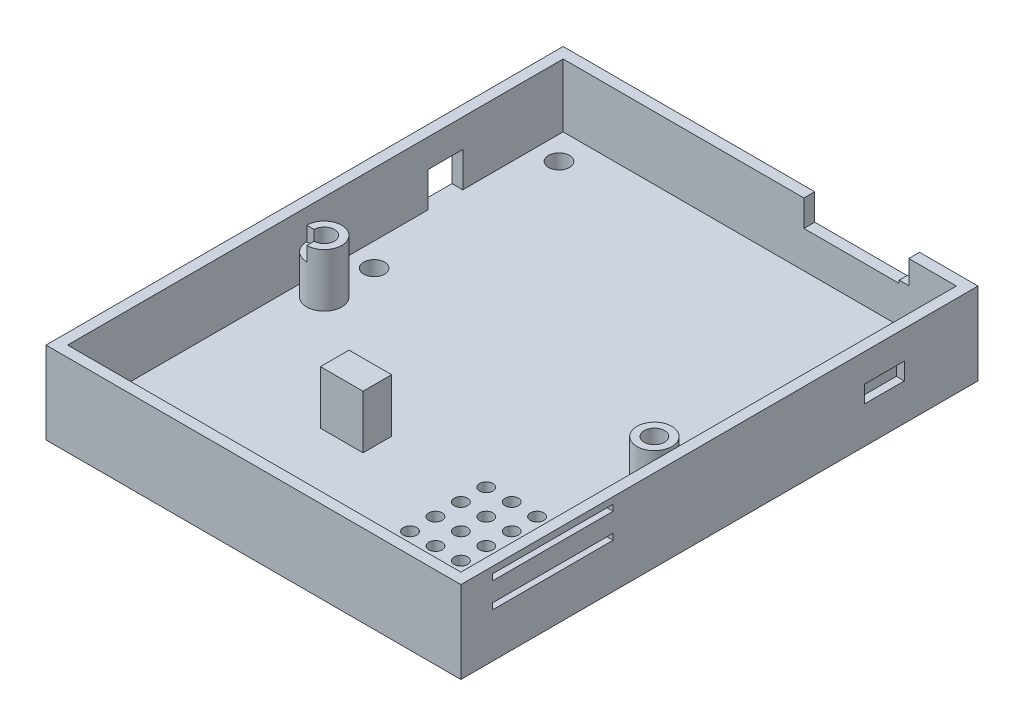
from build123d import *

# Parameters (mm, degrees)
SKETCH2_W                = 65.3
SKETCH2_H                = 81.4
BOSS_EXTRUDE1_DEPTH      = 3
SKETCH3_W                = 65.3
SKETCH3_H                = 81.4
SKETCH3_W_2              = 61.9
SKETCH3_H_2              = 78
BOSS_EXTRUDE2_DEPTH      = 9.94
SKETCH4_R                = 1.65
SKETCH4_R_2              = 1.6
SKETCH4_W                = 6.7
SKETCH4_H                = 4.5
CUT_EXTRUDE1_DEPTH       = 90.156922291
BOSS_EXTRUDE3_DEPTH      = 10.15
BOSS_EXTRUDE3_DEPTH_BACK = 3
SKETCH5_W                = 6.7
SKETCH5_H                = 4.5
SKETCH6_R                = 2.75
BOSS_EXTRUDE4_DEPTH      = 10.15
BOSS_EXTRUDE4_2_DEPTH    = 10.15
CUT_EXTRUDE2_DEPTH       = 4
SKETCH17_R               = 1.6
CUT_EXTRUDE11_DEPTH      = 90.571623254
SKETCH19_W               = 5.5
SKETCH19_H               = 5.5
CUT_EXTRUDE12_DEPTH      = 98.237493387
SKETCH20_W               = 15
SKETCH20_H               = 4.15
CUT_EXTRUDE13_DEPTH      = 96.592458239
SKETCH21_R               = 2.75
CUT_EXTRUDE14_DEPTH      = 1.75
SKETCH22_R               = 2.75
CUT_EXTRUDE15_DEPTH      = 1.75
SKETCH23_W               = 6.7
SKETCH23_H               = 4.5
CUT_EXTRUDE16_DEPTH      = 1.75
SKETCH10_R               = 1.05
CUT_EXTRUDE5_DEPTH       = 90.156922291
SKETCH11_W               = 6.3
SKETCH11_H               = 2.7
CUT_EXTRUDE6_DEPTH       = 1.25
SKETCH15_W               = 16.1
SKETCH15_H               = 3.7
CUT_EXTRUDE9_DEPTH       = 96.563796347
SKETCH16_W               = 18.956236151
SKETCH16_H               = 0.955067826
CUT_EXTRUDE10_DEPTH      = 1.7


with BuildPart() as part:
    # Sketch2 → Boss-Extrude1 (new body)
    with BuildSketch(Plane(origin=(0, 0, 0), x_dir=(1, 0, 0), z_dir=(0, 1, 0))):
        with Locations((-18.466588034, -31.668830446)):
            Rectangle(SKETCH2_W, SKETCH2_H)
    extrude(amount=BOSS_EXTRUDE1_DEPTH)

    # Sketch3 → Boss-Extrude2 (add)
    with BuildSketch(Plane(origin=(0, 3, 0), x_dir=(1, 0, 0), z_dir=(0, 1, 0))):
        with Locations((-18.466588034, -31.668830446)):
            Rectangle(SKETCH3_W, SKETCH3_H)
        with Locations((-18.466588034, -31.668830446)):
            Rectangle(SKETCH3_W_2, SKETCH3_H_2, mode=Mode.SUBTRACT)
    extrude(amount=BOSS_EXTRUDE2_DEPTH)

    # Sketch4 → Cut-Extrude1 (cut, through all)
    with BuildSketch(Plane(origin=(0, 3, 0), x_dir=(1, 0, 0), z_dir=(0, 1, 0))):
        with Locations(Location((-45.716588034, 2.981169554, 0), (0, 0, 270))):
            Circle(SKETCH4_R)
        with Locations(Location((-45.716588034, -26.118830446, 0), (0, 0, 270))):
            Circle(SKETCH4_R)
        with Locations(Location((7.483411966, 2.981169554, 0), (0, 0, 270))):
            Circle(SKETCH4_R)
        with Locations(Location((7.483411966, -26.118830446, 0), (0, 0, 270))):
            Circle(SKETCH4_R)
        with Locations(Location((-45.716588034, -33.968830446, 0), (0, 0, 270))):
            Circle(SKETCH4_R_2)
        with Locations(Location((7.677742326, -35.398830446, 0), (0, 0, 270))):
            Circle(SKETCH4_R_2)
        with Locations((-24.766588034, -49.918830446)):
            Rectangle(SKETCH4_W, SKETCH4_H)
    extrude(amount=-CUT_EXTRUDE1_DEPTH, mode=Mode.SUBTRACT)

    # Sketch19 → Cut-Extrude12 (cut, through all)
    with BuildSketch(Plane(origin=(-49.416588034, 0, 0), x_dir=(0, 0, -1), z_dir=(1, 0, 0))):
        with Locations((-11.218830446, 5.75)):
            Rectangle(SKETCH19_W, SKETCH19_H)
    extrude(amount=-CUT_EXTRUDE12_DEPTH, mode=Mode.SUBTRACT)

    # Sketch20 → Cut-Extrude13 (cut, through all)
    with BuildSketch(Plane.XY.offset(-7.331169554)):
        with Locations((-4.016588034, 10.865)):
            Rectangle(SKETCH20_W, SKETCH20_H)
    extrude(amount=-CUT_EXTRUDE13_DEPTH, mode=Mode.SUBTRACT)

    # Sketch10 → Cut-Extrude5 (cut, through all)
    with BuildSketch(Plane(origin=(0, 3, 0), x_dir=(1, 0, 0), z_dir=(0, 1, 0))):
        with Locations(Location((-7.016588034, -47.168830446, 0), (0, 0, 270))):
            Circle(SKETCH10_R)
        with Locations(Location((-3.016588034, -47.168830446, 0), (0, 0, 270))):
            Circle(SKETCH10_R)
        with Locations(Location((0.983411966, -47.168830446, 0), (0, 0, 270))):
            Circle(SKETCH10_R)
        with Locations(Location((4.983411966, -47.168830446, 0), (0, 0, 270))):
            Circle(SKETCH10_R)
        with Locations(Location((8.983411966, -47.168830446, 0), (0, 0, 270))):
            Circle(SKETCH10_R)
        with Locations(Location((-3.016588034, -51.168830446, 0), (0, 0, 270))):
            Circle(SKETCH10_R)
        with Locations(Location((0.983411966, -51.168830446, 0), (0, 0, 270))):
            Circle(SKETCH10_R)
        with Locations(Location((4.983411966, -51.168830446, 0), (0, 0, 270))):
            Circle(SKETCH10_R)
        with Locations(Location((8.983411966, -51.168830446, 0), (0, 0, 270))):
            Circle(SKETCH10_R)
        with Locations(Location((-3.016588034, -55.168830446, 0), (0, 0, 270))):
            Circle(SKETCH10_R)
        with Locations(Location((0.983411966, -55.168830446, 0), (0, 0, 270))):
            Circle(SKETCH10_R)
        with Locations(Location((4.983411966, -55.168830446, 0), (0, 0, 270))):
            Circle(SKETCH10_R)
        with Locations(Location((8.983411966, -55.168830446, 0), (0, 0, 270))):
            Circle(SKETCH10_R)
        with Locations(Location((-3.016588034, -59.168830446, 0), (0, 0, 270))):
            Circle(SKETCH10_R)
        with Locations(Location((0.983411966, -59.168830446, 0), (0, 0, 270))):
            Circle(SKETCH10_R)
        with Locations(Location((4.983411966, -59.168830446, 0), (0, 0, 270))):
            Circle(SKETCH10_R)
        with Locations(Location((8.983411966, -59.168830446, 0), (0, 0, 270))):
            Circle(SKETCH10_R)
        with Locations(Location((-7.016588034, -51.168830446, 0), (0, 0, 270))):
            Circle(SKETCH10_R)
        with Locations(Location((-7.016588034, -55.168830446, 0), (0, 0, 270))):
            Circle(SKETCH10_R)
        with Locations(Location((-7.016588034, -59.168830446, 0), (0, 0, 270))):
            Circle(SKETCH10_R)
    extrude(amount=-CUT_EXTRUDE5_DEPTH, mode=Mode.SUBTRACT)

    # Sketch11 → Cut-Extrude6 (cut)
    with BuildSketch(Plane(origin=(14.183411966, 0, 0), x_dir=(0, 0, -1), z_dir=(1, 0, 0))):
        with Locations((-5.718830446, 7.15)):
            Rectangle(SKETCH11_W, SKETCH11_H)
    extrude(amount=-CUT_EXTRUDE6_DEPTH, mode=Mode.SUBTRACT)

    # Sketch15 → Cut-Extrude9 (cut, through all)
    with BuildSketch(Plane.XY.offset(-7.331169554)):
        with Locations((-3.066588034, 11.09)):
            Rectangle(SKETCH15_W, SKETCH15_H)
    extrude(amount=-CUT_EXTRUDE9_DEPTH, mode=Mode.SUBTRACT)

    # Sketch16 → Cut-Extrude10 (cut)
    with BuildSketch(Plane(origin=(14.183411966, 0, 0), x_dir=(0, 0, -1), z_dir=(1, 0, 0))):
        with Locations((-57.890712371, 11.432601739)):
            Rectangle(SKETCH16_W, SKETCH16_H)
        with Locations((-57.890712371, 7.477533913)):
            Rectangle(SKETCH16_W, SKETCH16_H)
    extrude(amount=-CUT_EXTRUDE10_DEPTH, mode=Mode.SUBTRACT)


with BuildPart() as body_2:
    # Sketch5 → Boss-Extrude3 (new, two sides: drawn at the far end of the back side and taken through both)
    with BuildSketch(Plane(origin=(0, 3, 0), x_dir=(1, 0, 0), z_dir=(0, 1, 0)).offset(-BOSS_EXTRUDE3_DEPTH_BACK)):
        with Locations((-24.766588034, -49.918830446)):
            Rectangle(SKETCH5_W, SKETCH5_H)
    extrude(amount=BOSS_EXTRUDE3_DEPTH + BOSS_EXTRUDE3_DEPTH_BACK)

    # Sketch23 → Cut-Extrude16 (cut)
    with BuildSketch(Plane(origin=(0, 13.15, 0), x_dir=(1, 0, 0), z_dir=(0, 1, 0))):
        with Locations((-24.766588034, -49.918830446)):
            Rectangle(SKETCH23_W, SKETCH23_H)
    extrude(amount=-CUT_EXTRUDE16_DEPTH, mode=Mode.SUBTRACT)


with BuildPart() as body_3:
    # Sketch6 → Boss-Extrude4 (new body)
    with BuildSketch(Plane(origin=(0, 3, 0), x_dir=(1, 0, 0), z_dir=(0, 1, 0))):
        with Locations(Location((-45.716588034, -33.968830446, 0), (0, 0, 270))):
            Circle(SKETCH6_R)
    extrude(amount=BOSS_EXTRUDE4_DEPTH)

    # Sketch7 → Cut-Extrude2 (cut)
    with BuildSketch(Plane(origin=(0, 13.15, 0), x_dir=(1, 0, 0), z_dir=(0, 1, 0))):
        with BuildLine():
            Line((-48.466588034, -33.968830446), (-45.716588034, -33.968830446))
            Line((-45.716588034, -33.968830446), (-45.716588034, -36.718830446))
            ThreePointArc((-45.716588034, -36.718830446), (-47.661131682, -35.913374094), (-48.466588034, -33.968830446))
        make_face()
    extrude(amount=-CUT_EXTRUDE2_DEPTH, mode=Mode.SUBTRACT)


with BuildPart() as body_4:
    # Sketch6 → Boss-Extrude4 2 (new body)
    with BuildSketch(Plane(origin=(0, 3, 0), x_dir=(1, 0, 0), z_dir=(0, 1, 0))):
        with Locations(Location((7.677742326, -35.398830446, 0), (0, 0, 270))):
            Circle(SKETCH6_R)
    extrude(amount=BOSS_EXTRUDE4_2_DEPTH)


with BuildPart() as cut_extrude11_tool:
    # Sketch17 → Cut-Extrude11 (new, through all)
    with BuildSketch(Plane(origin=(0, 13.15, 0), x_dir=(1, 0, 0), z_dir=(0, 1, 0))):
        with Locations(Location((-45.716588034, -33.968830446, 0), (0, 0, 270))):
            Circle(SKETCH17_R)
        with Locations(Location((7.677742326, -35.398830446, 0), (0, 0, 270))):
            Circle(SKETCH17_R)
    extrude(amount=-CUT_EXTRUDE11_DEPTH)


with BuildPart() as body_3_1:
    add(body_3.part)

    # Cut-Extrude11: cut by cut_extrude11_tool
    add(cut_extrude11_tool.part, mode=Mode.SUBTRACT)

    # Sketch21 → Cut-Extrude14 (cut)
    with BuildSketch(Plane(origin=(0, 13.15, 0), x_dir=(1, 0, 0), z_dir=(0, 1, 0))):
        with Locations(Location((-45.716588034, -33.968830446, 0), (0, 0, 270))):
            Circle(SKETCH21_R)
    extrude(amount=-CUT_EXTRUDE14_DEPTH, mode=Mode.SUBTRACT)


with BuildPart() as body_4_1:
    add(body_4.part)

    # Cut-Extrude11: cut by cut_extrude11_tool
    add(cut_extrude11_tool.part, mode=Mode.SUBTRACT)

    # Sketch22 → Cut-Extrude15 (cut)
    with BuildSketch(Plane(origin=(0, 13.15, 0), x_dir=(1, 0, 0), z_dir=(0, 1, 0))):
        with Locations(Location((7.677742326, -35.398830446, 0), (0, 0, 270))):
            Circle(SKETCH22_R)
    extrude(amount=-CUT_EXTRUDE15_DEPTH, mode=Mode.SUBTRACT)


solid = Compound([part.part, body_2.part, body_3_1.part, body_4_1.part])
